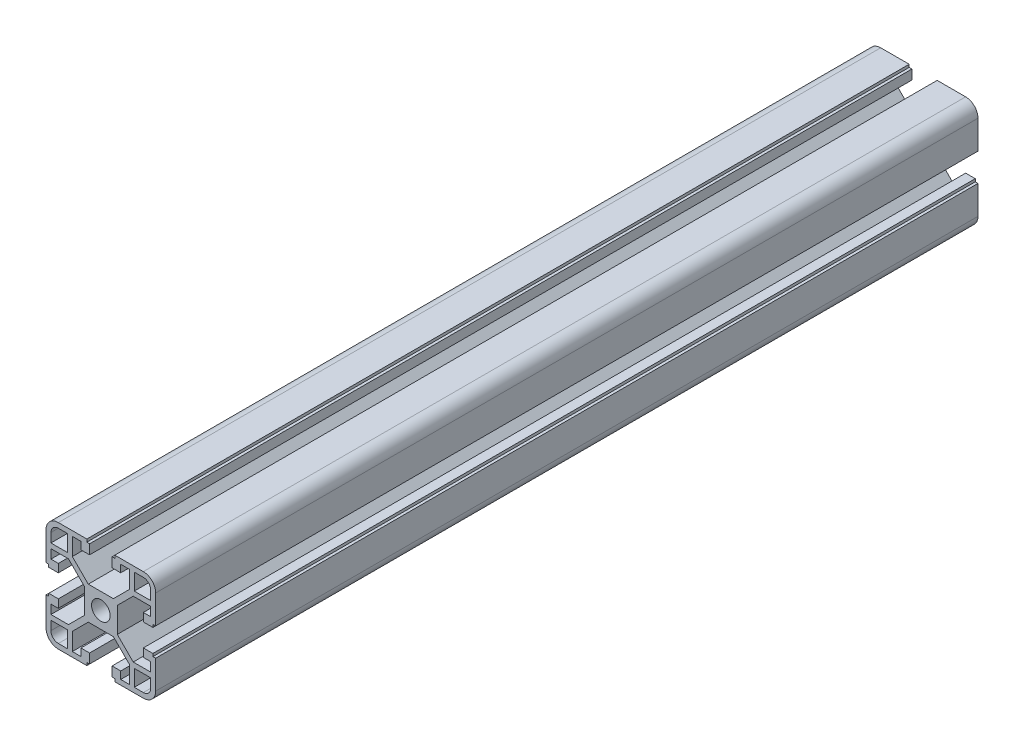
from build123d import *

# Parameters (mm, degrees)
SKETCH3_R           = 3.4
BOSS_EXTRUDE1_DEPTH = 300


with BuildPart() as part:
    # Sketch3 → Boss-Extrude1 (new body)
    with BuildSketch(Plane.XY):
        with BuildLine():
            Line((-11.814213562, 10.4), (-6, 4.585786438))
            Line((-6, 4.585786438), (-6, -4.585786438))
            Line((-6, -4.585786438), (-11.814213562, -10.4))
            Line((-11.814213562, -10.4), (-18.2, -10.4))
            Line((-18.2, -10.4), (-18.2, -7.1))
            Line((-18.2, -7.1), (-15.5, -7.1))
            Line((-15.5, -7.1), (-15.5, -4.1))
            Line((-15.5, -4.1), (-19, -4.1))
            Line((-19, -4.1), (-19, -5.1))
            Line((-19, -5.1), (-20, -5.1))
            Line((-20, -5.1), (-20, -15.5))
            ThreePointArc((-20, -15.5), (-18.681980515, -18.681980515), (-15.5, -20))
            Line((-15.5, -20), (-5.1, -20))
            Line((-5.1, -20), (-5.1, -19))
            Line((-5.1, -19), (-4.1, -19))
            Line((-4.1, -19), (-4.1, -15.5))
            Line((-4.1, -15.5), (-7.258114106, -15.5))
            Line((-7.258114106, -15.5), (-7.258114106, -18.2))
            Line((-7.258114106, -18.2), (-10.4, -18.2))
            Line((-10.4, -18.2), (-10.4, -11.814213562))
            Line((-10.4, -11.814213562), (-4.585786438, -6))
            Line((-4.585786438, -6), (4.585786438, -6))
            Line((4.585786438, -6), (10.4, -11.814213562))
            Line((10.4, -11.814213562), (10.4, -18.2))
            Line((10.4, -18.2), (7.258114106, -18.2))
            Line((7.258114106, -18.2), (7.258114106, -15.5))
            Line((7.258114106, -15.5), (4.1, -15.5))
            Line((4.1, -15.5), (4.1, -19))
            Line((4.1, -19), (5.1, -19))
            Line((5.1, -19), (5.1, -20))
            Line((5.1, -20), (15.5, -20))
            ThreePointArc((15.5, -20), (18.681980515, -18.681980515), (20, -15.5))
            Line((20, -15.5), (20, -5.1))
            Line((20, -5.1), (19, -5.1))
            Line((19, -5.1), (19, -4.1))
            Line((19, -4.1), (15.5, -4.1))
            Line((15.5, -4.1), (15.5, -7.1))
            Line((15.5, -7.1), (18.2, -7.1))
            Line((18.2, -7.1), (18.2, -10.4))
            Line((18.2, -10.4), (11.814213562, -10.4))
            Line((11.814213562, -10.4), (6, -4.585786438))
            Line((6, -4.585786438), (6, 4.585786438))
            Line((6, 4.585786438), (11.814213562, 10.4))
            Line((11.814213562, 10.4), (18.2, 10.4))
            Line((18.2, 10.4), (18.2, 7.1))
            Line((18.2, 7.1), (15.5, 7.1))
            Line((15.5, 7.1), (15.5, 4.1))
            Line((15.5, 4.1), (19, 4.1))
            Line((19, 4.1), (19, 5.1))
            Line((19, 5.1), (20, 5.1))
            Line((20, 5.1), (20, 15.5))
            ThreePointArc((20, 15.5), (18.681980515, 18.681980515), (15.5, 20))
            Line((15.5, 20), (5.1, 20))
            Line((5.1, 20), (5.1, 19))
            Line((5.1, 19), (4.1, 19))
            Line((4.1, 19), (4.1, 15.5))
            Line((4.1, 15.5), (7.258114106, 15.5))
            Line((7.258114106, 15.5), (7.258114106, 18.2))
            Line((7.258114106, 18.2), (10.4, 18.2))
            Line((10.4, 18.2), (10.4, 11.814213562))
            Line((10.4, 11.814213562), (4.585786438, 6))
            Line((4.585786438, 6), (-4.585786438, 6))
            Line((-4.585786438, 6), (-10.4, 11.814213562))
            Line((-10.4, 11.814213562), (-10.4, 18.2))
            Line((-10.4, 18.2), (-7.258114106, 18.2))
            Line((-7.258114106, 18.2), (-7.258114106, 15.5))
            Line((-7.258114106, 15.5), (-4.1, 15.5))
            Line((-4.1, 15.5), (-4.1, 19))
            Line((-4.1, 19), (-5.1, 19))
            Line((-5.1, 19), (-5.1, 20))
            Line((-5.1, 20), (-15.5, 20))
            ThreePointArc((-15.5, 20), (-18.681980515, 18.681980515), (-20, 15.5))
            Line((-20, 15.5), (-20, 5.1))
            Line((-20, 5.1), (-19, 5.1))
            Line((-19, 5.1), (-19, 4.1))
            Line((-19, 4.1), (-15.5, 4.1))
            Line((-15.5, 4.1), (-15.5, 7.1))
            Line((-15.5, 7.1), (-18.2, 7.1))
            Line((-18.2, 7.1), (-18.2, 10.4))
            Line((-18.2, 10.4), (-11.814213562, 10.4))
        make_face()
        with BuildLine():
            Line((-18.2, -15.5), (-18.2, -12.2))
            Line((-18.2, -12.2), (-12.2, -12.2))
            Line((-12.2, -12.2), (-12.2, -18.2))
            Line((-12.2, -18.2), (-15.5, -18.2))
            ThreePointArc((-15.5, -18.2), (-17.409188309, -17.409188309), (-18.2, -15.5))
        make_face(mode=Mode.SUBTRACT)
        Circle(SKETCH3_R, mode=Mode.SUBTRACT)
        with BuildLine():
            Line((-18.2, 12.2), (-18.2, 15.5))
            ThreePointArc((-18.2, 15.5), (-17.409188309, 17.409188309), (-15.5, 18.2))
            Line((-15.5, 18.2), (-12.2, 18.2))
            Line((-12.2, 18.2), (-12.2, 12.2))
            Line((-12.2, 12.2), (-18.2, 12.2))
        make_face(mode=Mode.SUBTRACT)
        with BuildLine():
            Line((18.2, 15.5), (18.2, 12.2))
            Line((18.2, 12.2), (12.2, 12.2))
            Line((12.2, 12.2), (12.2, 18.2))
            Line((12.2, 18.2), (15.5, 18.2))
            ThreePointArc((15.5, 18.2), (17.409188309, 17.409188309), (18.2, 15.5))
        make_face(mode=Mode.SUBTRACT)
        with BuildLine():
            Line((12.2, -18.2), (12.2, -12.2))
            Line((12.2, -12.2), (18.2, -12.2))
            Line((18.2, -12.2), (18.2, -15.5))
            ThreePointArc((18.2, -15.5), (17.409188309, -17.409188309), (15.5, -18.2))
            Line((15.5, -18.2), (12.2, -18.2))
        make_face(mode=Mode.SUBTRACT)
    extrude(amount=BOSS_EXTRUDE1_DEPTH)


solid = part.part
